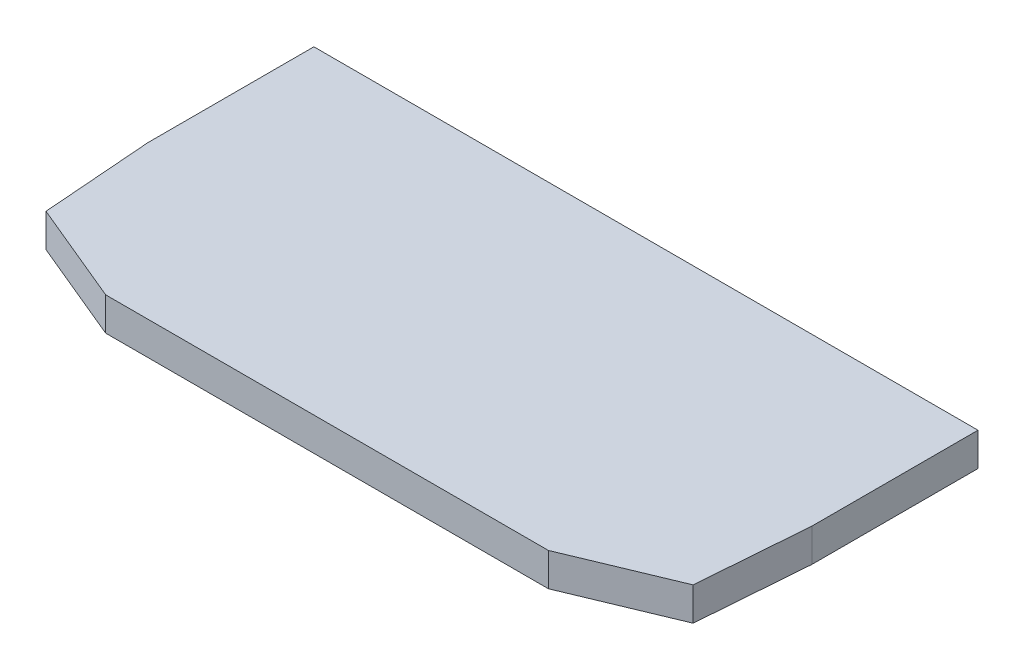
from build123d import *

# Parameters (mm, degrees)
BOSS_EXTRUDE1_DEPTH = 3


with BuildPart() as part:
    # Sketch3 → Boss-Extrude1 (new body)
    with BuildSketch(Plane(origin=(0, 0, 0), x_dir=(1, 0, 0), z_dir=(0, 1, 0))):
        Polygon((-27.141778753, 11.120048549), (32.858221247, 11.120048549), (32.858221247, -3.879951451), (32.090520251, -13.850439663), (22.858221247, -17.692919993), (-17.141778753, -17.692919993), (-26.374077758, -13.850439663), (-27.141778753, -3.879951451), align=None)
    extrude(amount=BOSS_EXTRUDE1_DEPTH)


solid = part.part
